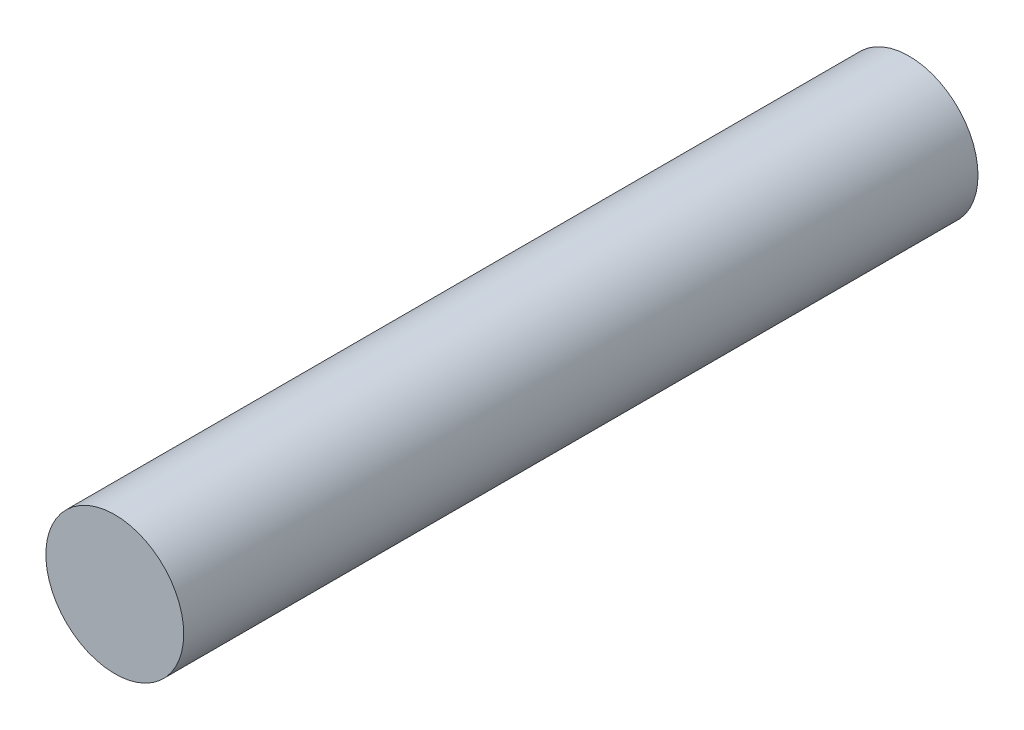
from build123d import *

# Parameters (mm, degrees)
SKETCH1_R           = 4
BOSS_EXTRUDE2_DEPTH = 46.1


with BuildPart() as part:
    # Sketch1 → Boss-Extrude2 (new body)
    with BuildSketch(Plane.XY):
        Circle(SKETCH1_R)
    extrude(amount=BOSS_EXTRUDE2_DEPTH)


solid = part.part
